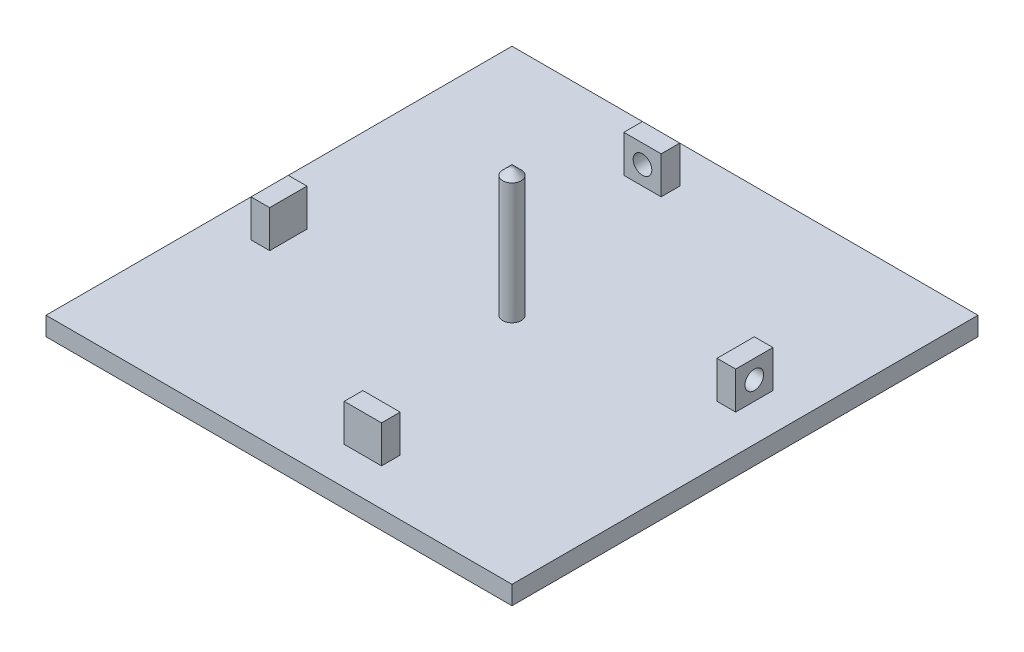
from build123d import *

# Parameters (mm, degrees)
SKETCH1_W           = 500
SKETCH1_H           = 500
BOSS_EXTRUDE1_DEPTH = 20
SKETCH1_3_W         = 20
SKETCH1_3_H         = 40
SKETCH1_3_W_2       = 40
SKETCH1_3_H_2       = 20
BOSS_EXTRUDE2_DEPTH = 40
SKETCH5_R           = 10
CUT_EXTRUDE1_DEPTH  = 526.071423713
SKETCH6_R           = 10
CUT_EXTRUDE2_DEPTH  = 526.071423713


with BuildPart() as part:
    # Sketch1 → Boss-Extrude1 (new body)
    with BuildSketch(Plane(origin=(0, 0, 0), x_dir=(1, 0, 0), z_dir=(0, 1, 0))):
        Rectangle(SKETCH1_W, SKETCH1_H)
    extrude(amount=-BOSS_EXTRUDE1_DEPTH)

    # Sketch1<3> → Boss-Extrude2 (add)
    with BuildSketch(Plane(origin=(0, 0, 0), x_dir=(1, 0, 0), z_dir=(0, 1, 0))):
        with Locations((200, 50)):
            Rectangle(SKETCH1_3_W, SKETCH1_3_H)
        with Locations((-50, 200)):
            Rectangle(SKETCH1_3_W_2, SKETCH1_3_H_2)
        with Locations((50, -200)):
            Rectangle(SKETCH1_3_W_2, SKETCH1_3_H_2)
        with Locations((-200, -50)):
            Rectangle(SKETCH1_3_W, SKETCH1_3_H)
    extrude(amount=BOSS_EXTRUDE2_DEPTH)

    # Sketch5 → Cut-Extrude1 (cut, through all)
    with BuildSketch(Plane(origin=(0, 0, -210), x_dir=(-1, 0, 0), z_dir=(0, 0, -1))):
        with Locations((50, 20)):
            Circle(SKETCH5_R)
    extrude(amount=-CUT_EXTRUDE1_DEPTH, mode=Mode.SUBTRACT)

    # Sketch6 → Cut-Extrude2 (cut, through all)
    with BuildSketch(Plane(origin=(210, 0, 0), x_dir=(0, 0, -1), z_dir=(1, 0, 0))):
        with Locations((50, 20)):
            Circle(SKETCH6_R)
    extrude(amount=-CUT_EXTRUDE2_DEPTH, mode=Mode.SUBTRACT)

    # Sketch7 → Revolve1 (revolve)
    with BuildSketch(Plane(origin=(0, 0, 0), x_dir=(0, 0, -1), z_dir=(1, 0, 0))):
        Polygon((0, 0), (0, 140), (10, 130), (10, 0), align=None)
    revolve(axis=Axis((0, 0, 0), (0, 1, 0)))


solid = part.part
